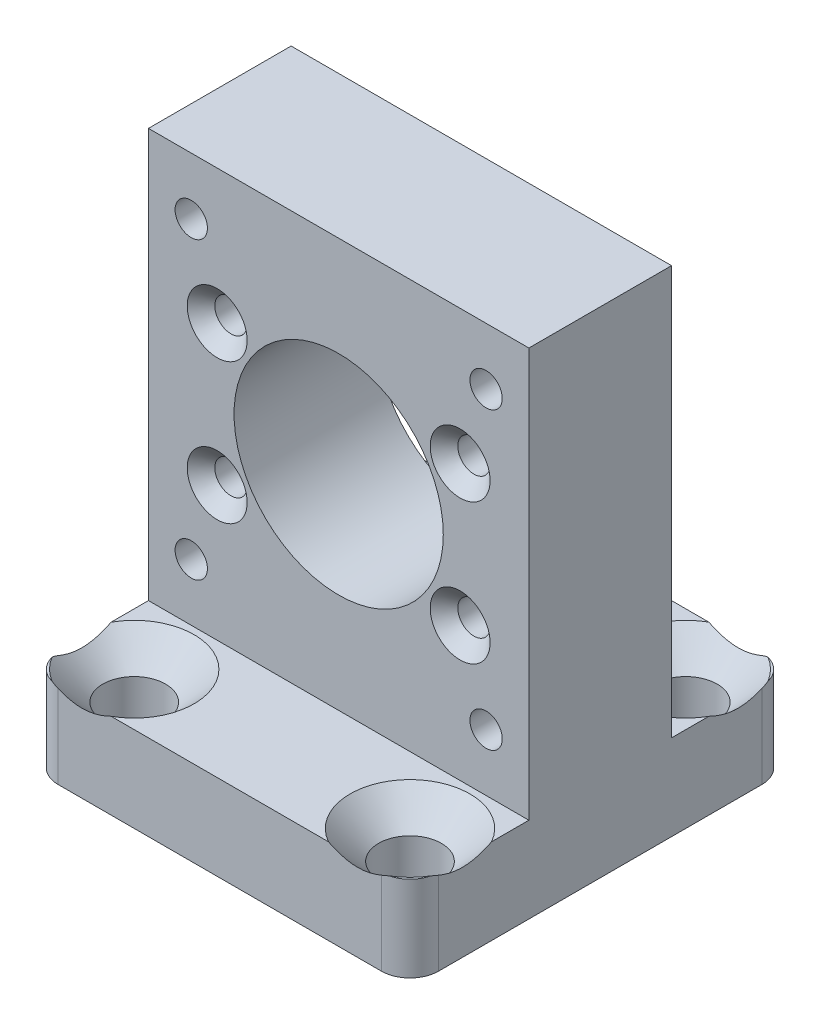
from build123d import *

# Parameters (mm, degrees)
SKETCH_1_W                 = 40
SKETCH_1_H                 = 43
EXTRUDE_284_DEPTH          = 7.5
NEMA17_M3_D                = 3.4
NEMA17_M3_CSINK_D          = 6.3
NEMA17_M3_CSINK_ANGLE      = 90
SKETCH_8_R                 = 11
CUT_EXTRUDE_1_DEPTH        = 33.973474188
SKETCH_12_W                = 40
SKETCH_12_H                = 40
EXTRUDE_1_DEPTH            = 9
FILLET_1_R                 = 3
HOLE_WIZARD_M6_D           = 6.6
HOLE_WIZARD_M6_CSINK_D     = 12.6
HOLE_WIZARD_M6_CSINK_ANGLE = 90
HOLE_WIZARD_M3_D           = 3.4
HOLE_WIZARD_M3_CSINK_D     = 6.3
HOLE_WIZARD_M3_CSINK_ANGLE = 90


with BuildPart() as part:
    # Эскиз1 → Extrude 284 (new, symmetric)
    with BuildSketch(Plane.XY):
        Rectangle(SKETCH_1_W, SKETCH_1_H)
    extrude(amount=EXTRUDE_284_DEPTH, both=True)

    # КреплениеNema17-M3 (through all)
    with Locations(Plane(origin=(0, 0, -7.5), x_dir=(-1, 0, 0), z_dir=(0, 0, -1))):
        with Locations((-15.5, 15.5), (15.5, 15.5), (15.5, -15.5), (-15.5, -15.5)):
            CounterSinkHole(NEMA17_M3_D / 2, NEMA17_M3_CSINK_D / 2, counter_sink_angle=NEMA17_M3_CSINK_ANGLE)

    # Эскиз8 → Вырез1 (cut, through all)
    with BuildSketch(Plane.XY.offset(7.5)):
        Circle(SKETCH_8_R)
    extrude(amount=-CUT_EXTRUDE_1_DEPTH, mode=Mode.SUBTRACT)

    # Эскиз12 → Бобышка-Вытянуть1 (add)
    with BuildSketch(Plane.XZ.offset(21.5)):
        Rectangle(SKETCH_12_W, SKETCH_12_H)
    extrude(amount=EXTRUDE_1_DEPTH)

    # Скругление1
    fillet_1_edges = [part.edges().sort_by_distance(p)[0] for p in [
        (-20, -26, 20),
        (-20, -26, -20),
        (20, -26, -20),
        (20, -26, 20),
    ]]
    fillet(fillet_1_edges, radius=FILLET_1_R)

    # КреплениеКронштейна-M6 (through all)
    with Locations(Plane(origin=(0, -21.5, 0), x_dir=(1, 0, 0), z_dir=(0, 1, 0))):
        with Locations((-14.5, -14.5), (14.5, -14.5), (14.5, 14.5), (-14.5, 14.5)):
            CounterSinkHole(HOLE_WIZARD_M6_D / 2, HOLE_WIZARD_M6_CSINK_D / 2, counter_sink_angle=HOLE_WIZARD_M6_CSINK_ANGLE)

    # КреплениеБлокаПодшипниковM3 (through all)
    with Locations(Plane.XY.offset(7.5)):
        with Locations((-12.773874706, 7.375), (12.773874706, 7.375), (12.773874706, -7.375), (-12.773874706, -7.375)):
            CounterSinkHole(HOLE_WIZARD_M3_D / 2, HOLE_WIZARD_M3_CSINK_D / 2, counter_sink_angle=HOLE_WIZARD_M3_CSINK_ANGLE)


solid = part.part
